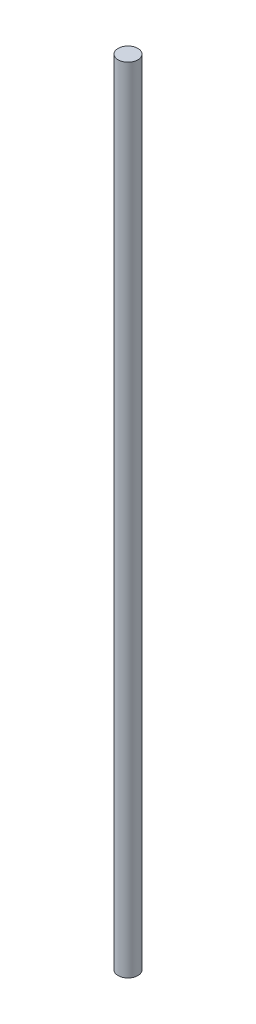
from build123d import *

# Parameters (mm, degrees)
SKETCH_1_R      = 10
EXTRUDE_1_DEPTH = 800


with BuildPart() as part:
    # 草图1 → 凸台-拉伸1 (new body)
    with BuildSketch(Plane(origin=(0, 0, 0), x_dir=(1, 0, 0), z_dir=(0, 1, 0))):
        with Locations(Location((0, 0, 0), (0, 0, 270))):
            Circle(SKETCH_1_R)
    extrude(amount=EXTRUDE_1_DEPTH)


solid = part.part
